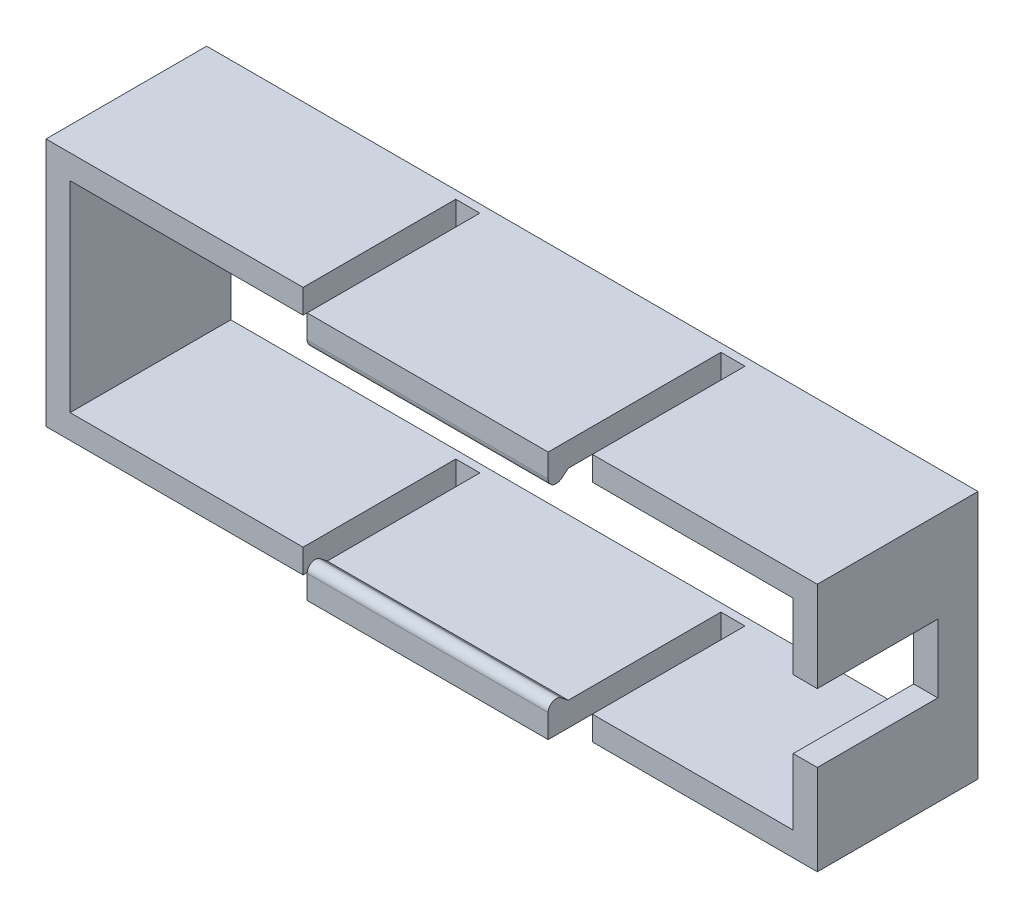
from build123d import *

# Parameters (mm, degrees)
SKETCH_1_W             = 96
SKETCH_1_H             = 31
SKETCH_1_W_2           = 90
SKETCH_1_H_2           = 25
EXTRUDE_1_DEPTH        = 20
SKETCH_2_W             = 42.974010058
SKETCH_2_H             = 8.5
CUT_EXTRUDE_1_DEPTH    = 15
SKETCH_3_W             = 3
SKETCH_3_H             = 65.210399997
CUT_EXTRUDE_1_2_DEPTH  = 19
EXTRUDE_1_2_DEPTH      = 30
FILLET_1_R             = 1
FILLET_1_OF_MIRROR_2_R = 1


with BuildPart() as part:
    # 草图1 → Extrude 1 (new body)
    with BuildSketch(Plane.XY):
        Rectangle(SKETCH_1_W, SKETCH_1_H)
        Rectangle(SKETCH_1_W_2, SKETCH_1_H_2, mode=Mode.SUBTRACT)
    extrude(amount=EXTRUDE_1_DEPTH)

    # 草图2 → Cut-Extrude 1 (cut)
    with BuildSketch(Plane.XY.offset(20)):
        with Locations((45, 0)):
            Rectangle(SKETCH_2_W, SKETCH_2_H)
    extrude(amount=-CUT_EXTRUDE_1_DEPTH, mode=Mode.SUBTRACT)

    # 草图3 → Cut-Extrude 1 2 (cut)
    with BuildSketch(Plane.XY.offset(20)):
        with Locations((-14.5, 3.518261773)):
            Rectangle(SKETCH_3_W, SKETCH_3_H)
        with Locations((18.5, 3.518261773)):
            Rectangle(SKETCH_3_W, SKETCH_3_H)
    extrude(amount=-CUT_EXTRUDE_1_2_DEPTH, mode=Mode.SUBTRACT)

    # 草图4 → Extrude 1 2 (add)
    with BuildSketch(Plane.ZY.offset(13)):
        Polygon((20, 15.5), (22.5, 15.5), (22.5, 10.5), (20, 12.5), align=None)
    extrude_1_2 = extrude(amount=-EXTRUDE_1_2_DEPTH)

    # 圆角1
    fillet_1_edges = [part.edges().sort_by_distance(p)[0] for p in [
        (2, 10.5, 22.5),
    ]]
    fillet(fillet_1_edges, radius=FILLET_1_R)

    # 镜向2: Extrude 1 2 across plane
    add(extrude_1_2.mirror(Plane.ZX))

    # 圆角1 of 镜向2
    fillet_1_of_mirror_2_edges = [part.edges().sort_by_distance(p)[0] for p in [
        (2, -10.5, 22.5),
    ]]
    fillet(fillet_1_of_mirror_2_edges, radius=FILLET_1_OF_MIRROR_2_R)


solid = part.part
